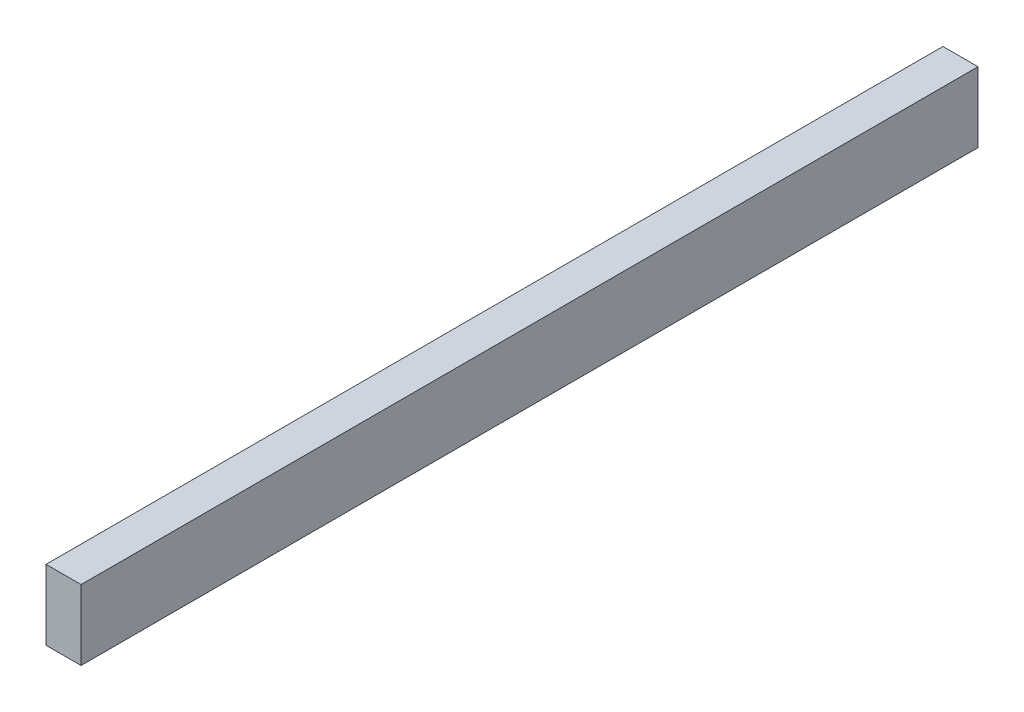
from build123d import *

# Parameters (mm, degrees)
SKETCH1_W           = 50.8
SKETCH1_H           = 101.6
BOSS_EXTRUDE1_DEPTH = 1300


with BuildPart() as part:
    # Sketch1 → Boss-Extrude1 (new body)
    with BuildSketch(Plane.XY):
        with Locations((25.4, 50.8)):
            Rectangle(SKETCH1_W, SKETCH1_H)
    extrude(amount=BOSS_EXTRUDE1_DEPTH)


solid = part.part
